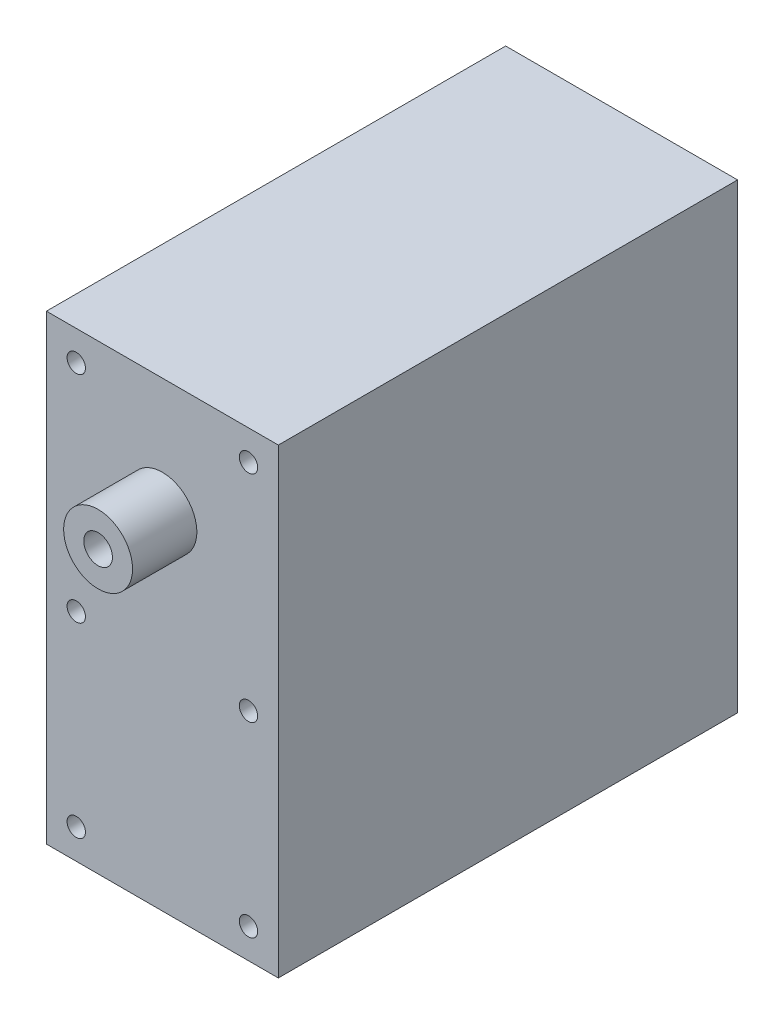
from build123d import *

# Parameters (mm, degrees)
SKETCH1_W           = 20.2
SKETCH1_H           = 40.2
BOSS_EXTRUDE1_DEPTH = 40
SKETCH2_R           = 0.8
CUT_EXTRUDE1_DEPTH  = 5
SKETCH3_R           = 3
SKETCH3_R_2         = 1.25
BOSS_EXTRUDE2_DEPTH = 5.6
BOSS_EXTRUDE3_START = 5.7
SKETCH4_R           = 3
SKETCH4_R_2         = 1.5
BOSS_EXTRUDE3_DEPTH = 5.7
SKETCH5_R           = 0.8
CUT_EXTRUDE2_DEPTH  = 5


with BuildPart() as part:
    # Sketch1 → Boss-Extrude1 (new body)
    with BuildSketch(Plane.XY):
        Rectangle(SKETCH1_W, SKETCH1_H)
    extrude(amount=BOSS_EXTRUDE1_DEPTH)

    # Sketch2 → Cut-Extrude1 (cut)
    with BuildSketch(Plane.XY.offset(40)):
        with Locations((-7.5, -17.5)):
            Circle(SKETCH2_R)
        with Locations(Location((-7.5, 17.5, 0), (0, 0, 180))):
            Circle(SKETCH2_R)
        with Locations(Location((7.5, -17.5, 0), (0, 0, 180))):
            Circle(SKETCH2_R)
        with Locations((7.5, 17.5)):
            Circle(SKETCH2_R)
        with Locations((-7.5, -1.25)):
            Circle(SKETCH2_R)
        with Locations(Location((7.5, -1.25, 0), (0, 0, 180))):
            Circle(SKETCH2_R)
    extrude(amount=-CUT_EXTRUDE1_DEPTH, mode=Mode.SUBTRACT)

    # Sketch3 → Boss-Extrude2 (add)
    with BuildSketch(Plane.XY.offset(40)):
        with Locations(Location((0, 10, 0), (0, 0, 180))):
            Circle(SKETCH3_R)
        with Locations((0, 10)):
            Circle(SKETCH3_R_2, mode=Mode.SUBTRACT)
    extrude(amount=BOSS_EXTRUDE2_DEPTH)

    # Sketch4 → Boss-Extrude3 (add)
    with BuildSketch(Plane(origin=(0, 0, 0), x_dir=(-1, 0, 0), z_dir=(0, 0, -1)).offset(BOSS_EXTRUDE3_START)):
        with Locations((0, 10)):
            Circle(SKETCH4_R)
        with Locations((0, 10)):
            Circle(SKETCH4_R_2, mode=Mode.SUBTRACT)
    extrude(amount=-BOSS_EXTRUDE3_DEPTH)

    # Sketch5 → Cut-Extrude2 (cut)
    with BuildSketch(Plane(origin=(0, 0, 0), x_dir=(-1, 0, 0), z_dir=(0, 0, -1))):
        with Locations((0, -17.15)):
            Circle(SKETCH5_R)
        with Locations((-7, -13.15)):
            Circle(SKETCH5_R)
        with Locations((-7, -10.15)):
            Circle(SKETCH5_R)
        with Locations(Location((7, -13.15, 0), (0, 0, 180))):
            Circle(SKETCH5_R)
        with Locations(Location((7, -10.15, 0), (0, 0, 180))):
            Circle(SKETCH5_R)
    extrude(amount=-CUT_EXTRUDE2_DEPTH, mode=Mode.SUBTRACT)


solid = part.part
